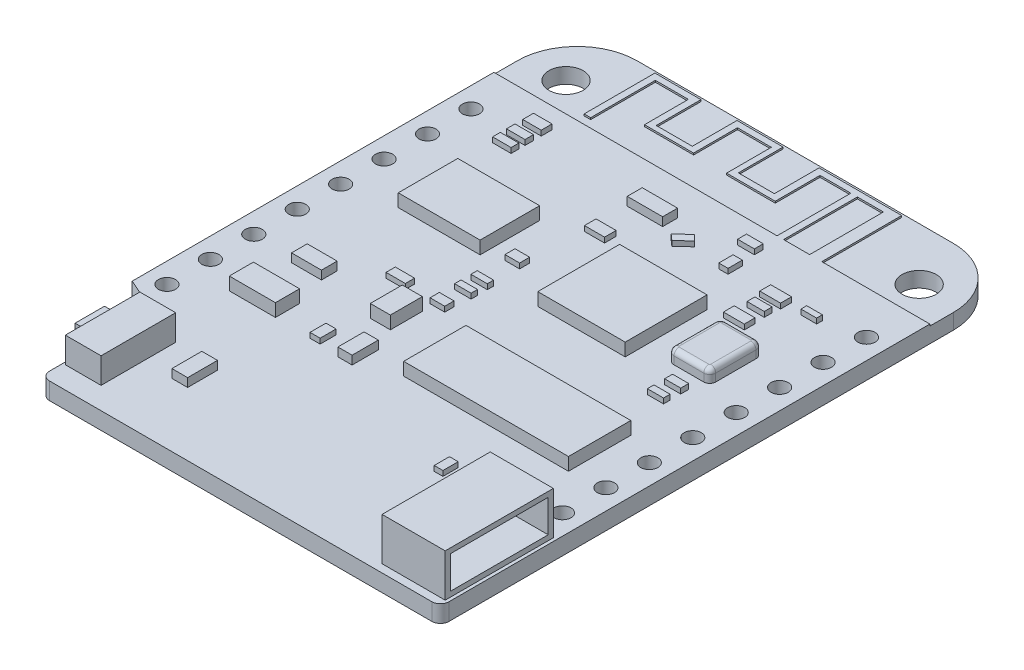
from build123d import *

# Parameters (mm, degrees)
SKETCH4_R           = 0.5
SKETCH4_R_2         = 1
BOSS_EXTRUDE1_DEPTH = 1
SKETCH5_W           = 3.691851451
SKETCH5_H           = 6.325200038
BOSS_EXTRUDE2_DEPTH = 2.5
SKETCH6_W           = 2.091188584
SKETCH6_H           = 4.36309717
BOSS_EXTRUDE3_DEPTH = 1.5
SKETCH7_W           = 1.718786234
SKETCH7_H           = 0.650194893
BOSS_EXTRUDE4_DEPTH = 0.75
SKETCH8_W           = 4.787165954
SKETCH8_H           = 3.48157524
SKETCH8_W_2         = 5.113563632
SKETCH8_H_2         = 4.787165954
SKETCH8_W_3         = 9.638336409
SKETCH8_H_3         = 3.644774079
SKETCH8_W_4         = 2.699444935
SKETCH8_H_4         = 1.411474476
SKETCH8_W_5         = 1.173907901
SKETCH8_H_5         = 1.870203681
BOSS_EXTRUDE5_DEPTH = 0.75
SKETCH9_W           = 1.524392434
SKETCH9_H           = 4.316642428
SKETCH9_R           = 1
CUT_EXTRUDE1_DEPTH  = 0.1
SKETCH10_W          = 0.918264734
SKETCH10_H          = 1.749075684
SKETCH10_W_2        = 0.83081095
SKETCH10_H_2        = 1.530441223
SKETCH10_W_3        = 1.749075684
SKETCH10_H_3        = 0.918264734
SKETCH10_W_4        = 2.069531713
SKETCH10_H_4        = 0.874537842
BOSS_EXTRUDE6_DEPTH = 0.5
SKETCH11_W          = 1.083640293
SKETCH11_H          = 0.632123504
SKETCH11_H_2        = 0.496668468
SKETCH11_H_3        = 0.451516789
SKETCH11_W_2        = 0.541820147
SKETCH11_H_4        = 0.83530606
SKETCH11_W_3        = 1.21909533
SKETCH11_H_5        = 0.643411424
SKETCH11_W_4        = 1.173943651
SKETCH11_H_6        = 0.677275183
SKETCH11_W_5        = 0.857881899
SKETCH11_H_7        = 0.586971825
SKETCH11_W_6        = 1.128791972
SKETCH11_H_8        = 0.541820147
SKETCH11_W_7        = 0.59099484
SKETCH11_H_9        = 0.933149747
SKETCH11_W_8        = 0.510171498
SKETCH11_H_10       = 0.89280012
BOSS_EXTRUDE7_DEPTH = 0.3
SKETCH12_W          = 0.979529275
SKETCH12_H          = 0.520374927
SKETCH12_W_2        = 0.918308696
SKETCH12_H_2        = 0.336713188
SKETCH12_W_3        = 1.010139564
SKETCH12_H_3        = 0.459154348
SKETCH12_W_4        = 0.945839899
SKETCH12_H_4        = 0.467081431
SKETCH12_H_5        = 0.385342181
SKETCH12_W_5        = 0.961227626
SKETCH12_H_6        = 0.370882105
SKETCH12_H_7        = 0.376952011
SKETCH12_W_6        = 0.514598529
SKETCH12_H_8        = 0.884053883
BOSS_EXTRUDE8_DEPTH = 0.3
BOSS_EXTRUDE9_DEPTH = 0.75
FILLET1_R           = 0.3
SKETCH14_W          = 5.725200038
SKETCH14_H          = 1.9
CUT_EXTRUDE2_DEPTH  = 2.3


with BuildPart() as part:
    # Sketch4 → Boss-Extrude1 (new body)
    with BuildSketch(Plane(origin=(0, 0, 0), x_dir=(1, 0, 0), z_dir=(0, 1, 0))):
        with BuildLine():
            Line((-9.25, 25.318253222), (9.25, 25.318253222))
            ThreePointArc((9.25, 25.318253222), (11.724873734, 24.293126956), (12.75, 21.818253222))
            Line((12.75, 21.818253222), (12.75, -7.681746778))
            ThreePointArc((12.75, -7.681746778), (12.603553391, -8.035300169), (12.25, -8.181746778))
            Line((12.25, -8.181746778), (-10.111693225, -8.181746778))
            ThreePointArc((-10.111693225, -8.181746778), (-10.465246615, -8.035300169), (-10.611693225, -7.681746778))
            Line((-10.611693225, -7.681746778), (-10.611693225, -1.976094139))
            ThreePointArc((-10.611693225, -1.976094139), (-10.692933786, -1.702889944), (-10.910255353, -1.518466797))
            Line((-10.910255353, -1.518466797), (-12.75, -0.708650137))
            Line((-12.75, -0.708650137), (-12.75, 21.818253222))
            ThreePointArc((-12.75, 21.818253222), (-11.724873734, 24.293126956), (-9.25, 25.318253222))
        make_face()
        with Locations(Location((-11.566316484, 17.920169852, 0), (0, 0, 270))):
            Circle(SKETCH4_R, mode=Mode.SUBTRACT)
        with Locations(Location((-11.566316484, 15.380169852, 0), (0, 0, 270))):
            Circle(SKETCH4_R, mode=Mode.SUBTRACT)
        with Locations(Location((-11.566316484, 12.840169852, 0), (0, 0, 270))):
            Circle(SKETCH4_R, mode=Mode.SUBTRACT)
        with Locations(Location((-11.566316484, 10.300169852, 0), (0, 0, 270))):
            Circle(SKETCH4_R, mode=Mode.SUBTRACT)
        with Locations(Location((-11.566316484, 7.760169852, 0), (0, 0, 270))):
            Circle(SKETCH4_R, mode=Mode.SUBTRACT)
        with Locations(Location((-11.566316484, 5.220169852, 0), (0, 0, 270))):
            Circle(SKETCH4_R, mode=Mode.SUBTRACT)
        with Locations(Location((-11.566316484, 2.680169852, 0), (0, 0, 270))):
            Circle(SKETCH4_R, mode=Mode.SUBTRACT)
        with Locations(Location((-11.566316484, 0.140169852, 0), (0, 0, 270))):
            Circle(SKETCH4_R, mode=Mode.SUBTRACT)
        with Locations(Location((11.566316484, 0.140169852, 0), (0, 0, 90))):
            Circle(SKETCH4_R, mode=Mode.SUBTRACT)
        with Locations(Location((11.566316484, 2.680169852, 0), (0, 0, 90))):
            Circle(SKETCH4_R, mode=Mode.SUBTRACT)
        with Locations(Location((11.566316484, 5.220169852, 0), (0, 0, 90))):
            Circle(SKETCH4_R, mode=Mode.SUBTRACT)
        with Locations(Location((11.566316484, 7.760169852, 0), (0, 0, 90))):
            Circle(SKETCH4_R, mode=Mode.SUBTRACT)
        with Locations(Location((11.566316484, 10.300169852, 0), (0, 0, 90))):
            Circle(SKETCH4_R, mode=Mode.SUBTRACT)
        with Locations(Location((11.566316484, 12.840169852, 0), (0, 0, 90))):
            Circle(SKETCH4_R, mode=Mode.SUBTRACT)
        with Locations(Location((11.566316484, 15.380169852, 0), (0, 0, 90))):
            Circle(SKETCH4_R, mode=Mode.SUBTRACT)
        with Locations(Location((11.566316484, 17.920169852, 0), (0, 0, 90))):
            Circle(SKETCH4_R, mode=Mode.SUBTRACT)
        with Locations(Location((10.326349128, 22.24137175, 0), (0, 0, 270))):
            Circle(SKETCH4_R_2, mode=Mode.SUBTRACT)
        with Locations(Location((-10.326349128, 22.24137175, 0), (0, 0, 90))):
            Circle(SKETCH4_R_2, mode=Mode.SUBTRACT)
    extrude(amount=-BOSS_EXTRUDE1_DEPTH)

    # Sketch5 → Boss-Extrude2 (add)
    with BuildSketch(Plane(origin=(0, 0, 0), x_dir=(1, 0, 0), z_dir=(0, 1, 0))):
        with Locations((10.717251668, -4.552236921)):
            Rectangle(SKETCH5_W, SKETCH5_H)
    extrude(amount=BOSS_EXTRUDE2_DEPTH)

    # Sketch6 → Boss-Extrude3 (add)
    with BuildSketch(Plane(origin=(0, 0, 0), x_dir=(1, 0, 0), z_dir=(0, 1, 0))):
        with Locations((-9.425953922, -4.716773578)):
            Rectangle(SKETCH6_W, SKETCH6_H)
    extrude(amount=BOSS_EXTRUDE3_DEPTH)

    # Sketch7 → Boss-Extrude4 (add)
    with BuildSketch(Plane.ZY.offset(10.471548214)):
        with Locations((4.716773578, 0.744820696)):
            Rectangle(SKETCH7_W, SKETCH7_H)
    extrude(amount=BOSS_EXTRUDE4_DEPTH)

    # Sketch8 → Boss-Extrude5 (add)
    with BuildSketch(Plane(origin=(0, 0, 0), x_dir=(1, 0, 0), z_dir=(0, 1, 0))):
        with Locations((-6.300750233, 12.536956647)):
            Rectangle(SKETCH8_W, SKETCH8_H)
        with Locations((2.947183996, 12.264958581)):
            Rectangle(SKETCH8_W_2, SKETCH8_H_2)
        with Locations((4.819168205, 4.241015648)):
            Rectangle(SKETCH8_W_3, SKETCH8_H_3)
        with Locations((-8.070397218, 2.345111336)):
            Rectangle(SKETCH8_W_4, SKETCH8_H_4)
        with Locations((-3.320213306, 5.309207736)):
            Rectangle(SKETCH8_W_5, SKETCH8_H_5)
    extrude(amount=BOSS_EXTRUDE5_DEPTH)

    # Sketch9 → Cut-Extrude1 (cut)
    # profile 1 of 2: a face of its own
    with BuildSketch(Plane(origin=(0, 0, 0), x_dir=(1, 0, 0), z_dir=(0, 1, 0))):
        with Locations((4.9533057, 22.604006337)):
            Rectangle(SKETCH9_W, SKETCH9_H)
    # profile 2 of 2: a face of its own
    with BuildSketch(Plane(origin=(0, 0, 0), x_dir=(1, 0, 0), z_dir=(0, 1, 0))):
        with BuildLine():
            Line((12.75, 20.445685123), (12.75, 21.818253222))
            ThreePointArc((12.75, 21.818253222), (11.724873734, 24.293126956), (9.25, 25.318253222))
            Line((9.25, 25.318253222), (-9.25, 25.318253222))
            ThreePointArc((-9.25, 25.318253222), (-11.724873734, 24.293126956), (-12.75, 21.818253222))
            Line((-12.75, 21.818253222), (-12.75, 20.445685123))
            Line((-12.75, 20.445685123), (3.810011374, 20.445685123))
            Line((3.810011374, 20.445685123), (3.810011374, 24.762327551))
            Line((3.810011374, 24.762327551), (2.006146994, 24.762327551))
            Line((2.006146994, 24.762327551), (2.006146994, 22.145453873))
            Line((2.006146994, 22.145453873), (-0.83938555, 22.145453873))
            Line((-0.83938555, 22.145453873), (-0.83938555, 24.762327551))
            Line((-0.83938555, 24.762327551), (-2.821095714, 24.762327551))
            Line((-2.821095714, 24.762327551), (-2.821095714, 22.196266954))
            Line((-2.821095714, 22.196266954), (-5.692034799, 22.196266954))
            Line((-5.692034799, 22.196266954), (-5.692034799, 24.762327551))
            Line((-5.692034799, 24.762327551), (-7.622931882, 24.762327551))
            Line((-7.622931882, 24.762327551), (-7.622931882, 20.976753007))
            Line((-7.622931882, 20.976753007), (-8.00402999, 20.976753007))
            Line((-8.00402999, 20.976753007), (-8.00402999, 25.118019119))
            Line((-8.00402999, 25.118019119), (-5.31093669, 25.118019119))
            Line((-5.31093669, 25.118019119), (-5.31093669, 22.501145441))
            Line((-5.31093669, 22.501145441), (-3.202193823, 22.501145441))
            Line((-3.202193823, 22.501145441), (-3.202193823, 25.118019119))
            Line((-3.202193823, 25.118019119), (-0.509100523, 25.118019119))
            Line((-0.509100523, 25.118019119), (-0.509100523, 22.501145441))
            Line((-0.509100523, 22.501145441), (1.599642345, 22.501145441))
            Line((1.599642345, 22.501145441), (1.599642345, 25.118019119))
            Line((1.599642345, 25.118019119), (6.426885053, 25.118019119))
            Line((6.426885053, 25.118019119), (6.426885053, 20.445685123))
            Line((6.426885053, 20.445685123), (12.75, 20.445685123))
        make_face()
        with Locations(Location((10.326349128, 22.24137175, 0), (0, 0, 270))):
            Circle(SKETCH9_R, mode=Mode.SUBTRACT)
        with Locations(Location((-10.326349128, 22.24137175, 0), (0, 0, 270))):
            Circle(SKETCH9_R, mode=Mode.SUBTRACT)
    extrude(amount=-CUT_EXTRUDE1_DEPTH, mode=Mode.SUBTRACT)

    # Sketch10 → Boss-Extrude6 (add)
    with BuildSketch(Plane(origin=(0, 0, 0), x_dir=(1, 0, 0), z_dir=(0, 1, 0))):
        with Locations((-6.201723016, -3.599567411)):
            Rectangle(SKETCH10_W, SKETCH10_H)
        with Locations((-2.484937188, 2.237972683)):
            Rectangle(SKETCH10_W_2, SKETCH10_H_2)
        with Locations((-8.147569714, 5.342582022)):
            Rectangle(SKETCH10_W_3, SKETCH10_H_3)
        with Locations((-1.034765856, 18.001517283)):
            Rectangle(SKETCH10_W_4, SKETCH10_H_4)
    extrude(amount=BOSS_EXTRUDE6_DEPTH)

    # Sketch11 → Boss-Extrude7 (add)
    with BuildSketch(Plane(origin=(0, 0, 0), x_dir=(1, 0, 0), z_dir=(0, 1, 0))):
        with Locations((-8.677150299, 18.916069823)):
            Rectangle(SKETCH11_W, SKETCH11_H)
        with Locations((-8.677150299, 17.900157048)):
            Rectangle(SKETCH11_W, SKETCH11_H_2)
        with Locations((-8.677150299, 17.064850988)):
            Rectangle(SKETCH11_W, SKETCH11_H_3)
        with Locations((4.055623146, 17.482504018)):
            Rectangle(SKETCH11_W_2, SKETCH11_H_4)
        with Locations((7.013058112, 17.160798306)):
            Rectangle(SKETCH11_W_3, SKETCH11_H_5)
        with Locations((7.013058112, 15.033025439)):
            Rectangle(SKETCH11_W_3, SKETCH11_H)
        with Locations((-1.452881679, 15.371663031)):
            Rectangle(SKETCH11_W_4, SKETCH11_H_6)
        with Locations((-2.468794454, 11.533770326)):
            Rectangle(SKETCH11_W_5, SKETCH11_H_7)
        with Locations((-4.906985113, 7.131481635)):
            Rectangle(SKETCH11_W_6, SKETCH11_H_8)
        with Locations((-2.468794454, 7.131481635)):
            Rectangle(SKETCH11_W_5, SKETCH11_H_8)
        with Locations((-4.360829728, 2.065371155)):
            Rectangle(SKETCH11_W_7, SKETCH11_H_9)
        with Locations((5.972910163, -1.065745804)):
            Rectangle(SKETCH11_W_8, SKETCH11_H_10)
    extrude(amount=BOSS_EXTRUDE7_DEPTH)

    # Sketch12 → Boss-Extrude8 (add)
    with BuildSketch(Plane(origin=(0, 0, 0), x_dir=(1, 0, 0), z_dir=(0, 1, 0))):
        Polygon((0.926194501, 17.1355865), (1.630231167, 17.809012876), (1.952304652, 17.472299688), (1.278212834, 16.82751621), align=None)
        with Locations((3.619900006, 19.079339905)):
            Rectangle(SKETCH12_W, SKETCH12_H)
        with Locations((8.976700729, 17.303943094)):
            Rectangle(SKETCH12_W_2, SKETCH12_H_2)
        with Locations((7.063557614, 16.17136237)):
            Rectangle(SKETCH12_W_3, SKETCH12_H_3)
        with Locations((8.534984268, 9.84820997)):
            Rectangle(SKETCH12_W_4, SKETCH12_H_4)
        with Locations((8.534984268, 8.803115267)):
            Rectangle(SKETCH12_W_4, SKETCH12_H_5)
        with Locations((-2.411899314, 9.429228202)):
            Rectangle(SKETCH12_W_5, SKETCH12_H_6)
        with Locations((-2.411899314, 8.480459329)):
            Rectangle(SKETCH12_W_5, SKETCH12_H_7)
        with Locations((7.039881131, -1.058422706)):
            Rectangle(SKETCH12_W_6, SKETCH12_H_8)
    extrude(amount=BOSS_EXTRUDE8_DEPTH)

    # Sketch13 → Boss-Extrude9 (add)
    with BuildSketch(Plane(origin=(0, 0, 0), x_dir=(1, 0, 0), z_dir=(0, 1, 0))):
        with BuildLine():
            Line((7.335599691, 13.951090026), (9.073274988, 13.951090026))
            ThreePointArc((9.073274988, 13.951090026), (9.320762361, 13.8485774), (9.423274988, 13.601090026))
            Line((9.423274988, 13.601090026), (9.423274988, 11.246281743))
            ThreePointArc((9.423274988, 11.246281743), (9.320762361, 10.998794369), (9.073274988, 10.896281743))
            Line((9.073274988, 10.896281743), (7.335599691, 10.896281743))
            ThreePointArc((7.335599691, 10.896281743), (7.088112317, 10.998794369), (6.985599691, 11.246281743))
            Line((6.985599691, 11.246281743), (6.985599691, 13.601090026))
            ThreePointArc((6.985599691, 13.601090026), (7.088112317, 13.8485774), (7.335599691, 13.951090026))
        make_face()
    extrude(amount=BOSS_EXTRUDE9_DEPTH)

    # Fillet1
    fillet1_edges = [part.edges().sort_by_distance(p)[0] for p in [
        (7.088112317, 0.75, -10.998794369),
        (8.204437339, 0.75, -10.896281743),
        (9.320762361, 0.75, -10.998794369),
        (9.423274988, 0.75, -12.423685884),
        (9.320762361, 0.75, -13.8485774),
        (8.204437339, 0.75, -13.951090026),
        (7.088112317, 0.75, -13.8485774),
        (6.985599691, 0.75, -12.423685884),
    ]]
    fillet(fillet1_edges, radius=FILLET1_R)

    # Sketch14 → Cut-Extrude2 (cut)
    with BuildSketch(Plane(origin=(12.563177393, 0, 0), x_dir=(0, 0, -1), z_dir=(1, 0, 0))):
        with Locations((-4.552236921, 1.25)):
            Rectangle(SKETCH14_W, SKETCH14_H)
    extrude(amount=-CUT_EXTRUDE2_DEPTH, mode=Mode.SUBTRACT)


solid = part.part
